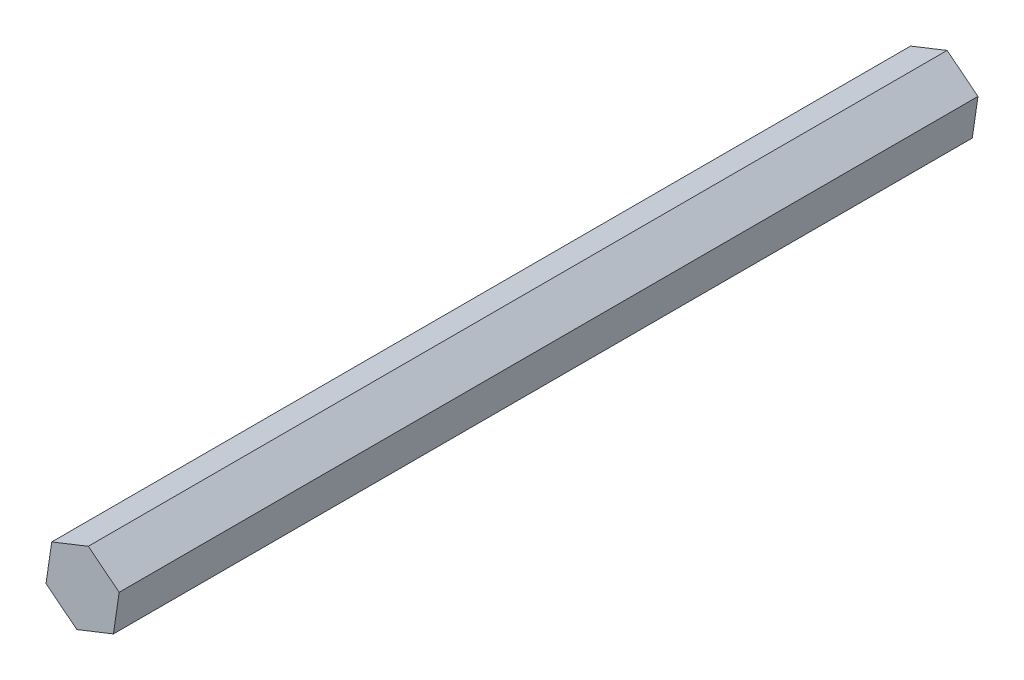
from build123d import *

# Parameters (mm, degrees)
BOSS_EXTRUDE1_DEPTH = 160.02


with BuildPart() as part:
    # Sketch1 → Boss-Extrude1 (new body)
    with BuildSketch(Plane.XY):
        Polygon((1.064896502, 7.254607417), (-5.750226067, 4.549531131), (-6.815122568, -2.705076286), (-1.064896502, -7.254607417), (5.750226067, -4.549531131), (6.815122568, 2.705076286), align=None)
    extrude(amount=BOSS_EXTRUDE1_DEPTH)


solid = part.part
